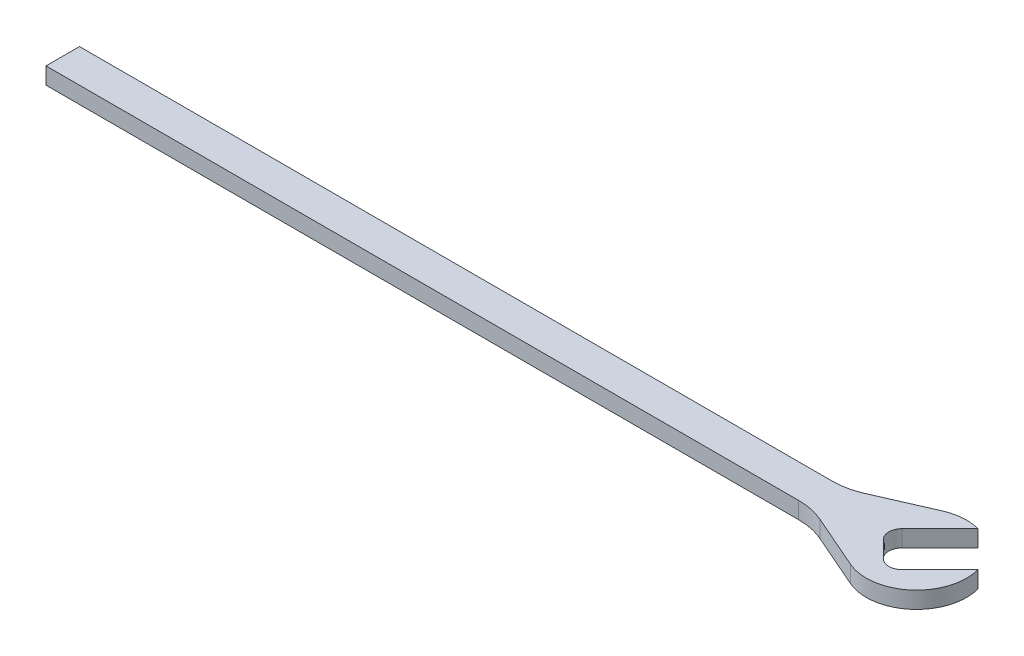
from build123d import *

# Parameters (mm, degrees)
BOSS_EXTRUDE1_DEPTH = 3.175


with BuildPart() as part:
    # Sketch1 → Boss-Extrude1 (new body)
    with BuildSketch(Plane(origin=(0, 0, 0), x_dir=(1, 0, 0), z_dir=(0, 1, 0))):
        with BuildLine():
            Line((1.259536023, 2.586263405), (-100.340463977, 2.586263405))
            Line((-100.340463977, 2.586263405), (-103.395029965, 2.586263405))
            Line((-103.395029965, 2.586263405), (-103.395029965, -3.763736604))
            Line((-103.395029965, -3.763736604), (39.35953602, -3.763736604))
            add(Edge.make_bspline(
                [(39.35953602, -3.763736604), (40.672498996, -3.763736604), (41.958231282, -4.032454171), (43.243430957, -4.301060422), (44.446955668, -4.827235355)],
                knots=[0, 0, 0, 0.5, 0.5, 1, 1, 1], degree=2))
            Line((44.446955668, -4.827235355), (54.714405304, -9.316112529))
            add(Edge.make_bspline(
                [(54.714405304, -9.316112529), (55.946669165, -9.854852073), (57.28046692, -10.031425137), (58.61345219, -10.207890641), (59.944261722, -10.008152925), (61.273983438, -9.808578475), (62.497433966, -9.248116189), (63.719884433, -8.68811203), (64.740280541, -7.810763211), (65.759842568, -6.934131546), (66.497371281, -5.80852035), (67.234297131, -4.683829239), (67.631270692, -3.397998317), (68.027919764, -2.113218446), (68.053287839, -0.767742461), (68.078640466, 0.576914214), (67.730413535, 1.876514813)],
                knots=[0, 0, 0, 0.125, 0.125, 0.25, 0.25, 0.375, 0.375, 0.5, 0.5, 0.625, 0.625, 0.75, 0.75, 0.875, 0.875, 1, 1, 1], degree=2))
            Line((67.730413535, 1.876514813), (60.546208639, -5.307690084))
            add(Edge.make_bspline(
                [(60.546208639, -5.307690084), (60.189154092, -5.664744631), (59.722173333, -5.858292872), (59.255944804, -6.051529339), (58.750157415, -6.05163886), (58.245470025, -6.051748143), (57.778141496, -5.858292872), (57.311565034, -5.665148928), (56.954106191, -5.307690084)],
                knots=[0, 0, 0, 0.25, 0.25, 0.5, 0.5, 0.75, 0.75, 1, 1, 1], degree=2))
            Line((56.954106191, -5.307690084), (53.811016549, -2.164600442))
            add(Edge.make_bspline(
                [(53.811016549, -2.164600442), (53.453962002, -1.807545895), (53.26041376, -1.340565136), (53.067177294, -0.874336608), (53.067067773, -0.368549218), (53.06695849, 0.136138171), (53.26041376, 0.6034667), (53.453557705, 1.070043162), (53.811016549, 1.427502006)],
                knots=[0, 0, 0, 0.25, 0.25, 0.5, 0.5, 0.75, 0.75, 1, 1, 1], degree=2))
            Line((53.811016549, 1.427502006), (60.995221446, 8.611706903))
            ThreePointArc((60.995221446, 8.611706903), (59.773232018, 8.854775714), (58.529970033, 8.93626341))
            ThreePointArc((58.529970033, 8.93626341), (56.580948585, 8.734725234), (54.714405295, 8.138639345))
            Line((54.714405295, 8.138639345), (44.446955671, 3.649762156))
            add(Edge.make_bspline(
                [(44.446955671, 3.649762156), (43.243940291, 3.1238099), (41.958231285, 2.854980972), (40.67305488, 2.586263405), (39.359536023, 2.586263405)],
                knots=[0, 0, 0, 0.5, 0.5, 1, 1, 1], degree=2))
            Line((39.359536023, 2.586263405), (1.259536023, 2.586263405))
        make_face()
    extrude(amount=BOSS_EXTRUDE1_DEPTH)


solid = part.part
